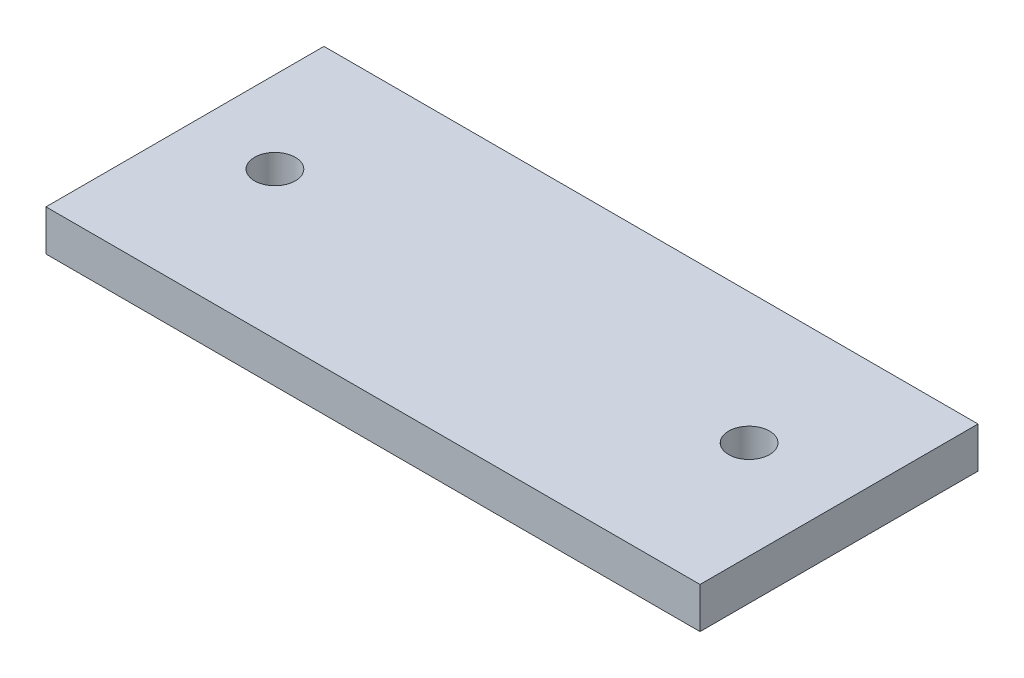
from build123d import *

# Parameters (mm, degrees)
SKETCH1_W           = 50.8
SKETCH1_H           = 21.59
SKETCH1_R           = 1.5875
BOSS_EXTRUDE1_DEPTH = 3.175


with BuildPart() as part:
    # Sketch1 → Boss-Extrude1 (new body)
    with BuildSketch(Plane(origin=(0, 0, 0), x_dir=(1, 0, 0), z_dir=(0, 1, 0))):
        Rectangle(SKETCH1_W, SKETCH1_H)
        with Locations(Location((-19.05, 0.635, 0), (0, 0, 270))):
            Circle(SKETCH1_R, mode=Mode.SUBTRACT)
        with Locations(Location((17.78, 0.635, 0), (0, 0, 270))):
            Circle(SKETCH1_R, mode=Mode.SUBTRACT)
    extrude(amount=BOSS_EXTRUDE1_DEPTH)


solid = part.part
